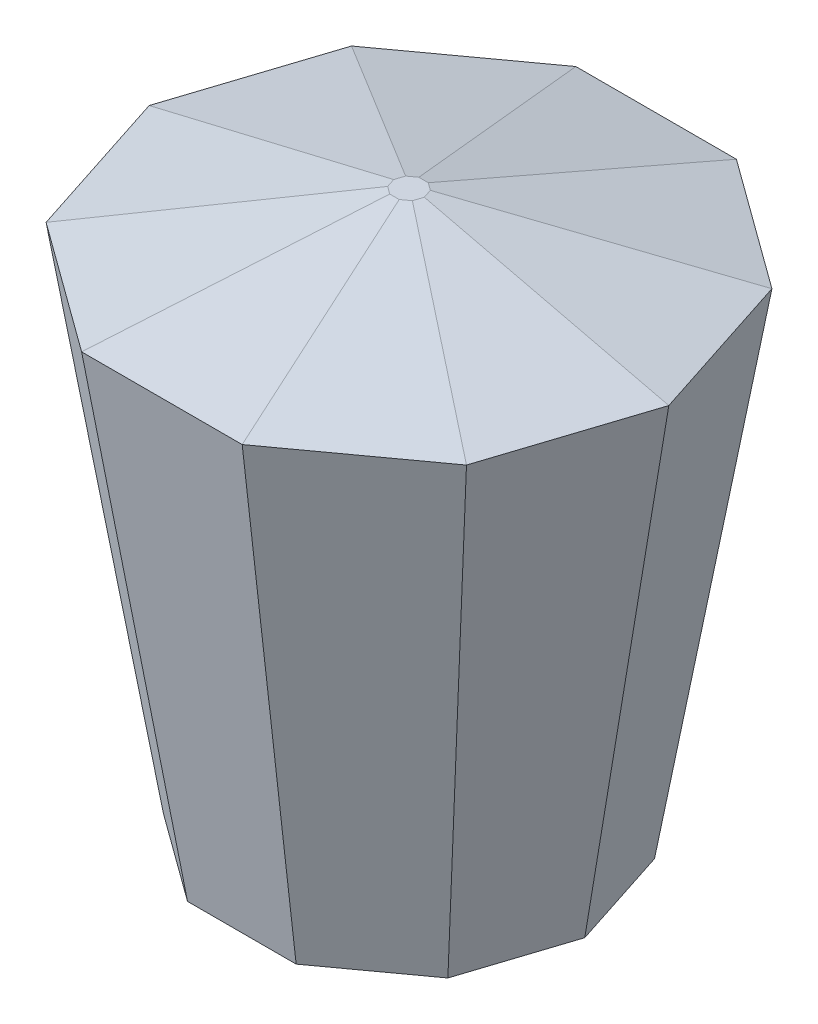
from build123d import *

# Parameters (mm, degrees)
CROQUIS5_R            = 1.5
CORTAR_EXTRUIR1_DEPTH = 18


with BuildPart() as part:
    # Croquis1 → Recubrir1 section 0
    with BuildSketch(Plane(origin=(0, 0, 0), x_dir=(1, 0, 0), z_dir=(0, 1, 0))):
        with BuildLine():
            Line((4.891242148, 3.553695435), (1.868288253, 5.75))
            Line((1.868288253, 5.75), (-1.868288253, 5.75))
            Line((-1.868288253, 5.75), (-4.891242148, 3.553695435))
            Line((-4.891242148, 3.553695435), (-6.045907789, 0))
            Line((-6.045907789, 0), (-4.891242148, -3.553695435))
            Line((-4.891242148, -3.553695435), (-1.868288253, -5.75))
            Line((-1.868288253, -5.75), (1.868288253, -5.75))
            Line((1.868288253, -5.75), (4.891242148, -3.553695435))
            Line((4.891242148, -3.553695435), (6.045907789, 0))
            Line((6.045907789, 0), (4.891242148, 3.553695435))
        make_face()
    # Croquis2 → Recubrir1 section 1
    with BuildSketch(Plane(origin=(0, 17.3, 0), x_dir=(1, 0, 0), z_dir=(0, 1, 0))):
        with BuildLine():
            Line((-8.937428906, 0), (-7.230531871, -5.253288904))
            Line((-7.230531871, -5.253288904), (-2.761817418, -8.5))
            Line((-2.761817418, -8.5), (2.761817418, -8.5))
            Line((2.761817418, -8.5), (7.230531871, -5.253288904))
            Line((7.230531871, -5.253288904), (8.937428906, 0))
            Line((8.937428906, 0), (7.230531871, 5.253288904))
            Line((7.230531871, 5.253288904), (2.761817418, 8.5))
            Line((2.761817418, 8.5), (-2.761817418, 8.5))
            Line((-2.761817418, 8.5), (-7.230531871, 5.253288904))
            Line((-7.230531871, 5.253288904), (-8.937428906, 0))
        make_face()
    loft()

    # Croquis4 → Recubrir2 section 0
    with BuildSketch(Plane(origin=(0, 19.3, 0), x_dir=(1, 0, 0), z_dir=(0, 1, 0))):
        with BuildLine():
            Line((-0.525731112, 0), (-0.425325404, -0.309016994))
            Line((-0.425325404, -0.309016994), (-0.162459848, -0.5))
            Line((-0.162459848, -0.5), (0.162459848, -0.5))
            Line((0.162459848, -0.5), (0.425325404, -0.309016994))
            Line((0.425325404, -0.309016994), (0.525731112, 0))
            Line((0.525731112, 0), (0.425325404, 0.309016994))
            Line((0.425325404, 0.309016994), (0.162459848, 0.5))
            Line((0.162459848, 0.5), (-0.162459848, 0.5))
            Line((-0.162459848, 0.5), (-0.425325404, 0.309016994))
            Line((-0.425325404, 0.309016994), (-0.525731112, 0))
        make_face()
    # Croquis2<3> → Recubrir2 section 1
    with BuildSketch(Plane(origin=(0, 17.3, 0), x_dir=(1, 0, 0), z_dir=(0, 1, 0))):
        with BuildLine():
            Line((-8.937428906, 0), (-7.230531871, -5.253288904))
            Line((-7.230531871, -5.253288904), (-2.761817418, -8.5))
            Line((-2.761817418, -8.5), (2.761817418, -8.5))
            Line((2.761817418, -8.5), (7.230531871, -5.253288904))
            Line((7.230531871, -5.253288904), (8.937428906, 0))
            Line((8.937428906, 0), (7.230531871, 5.253288904))
            Line((7.230531871, 5.253288904), (2.761817418, 8.5))
            Line((2.761817418, 8.5), (-2.761817418, 8.5))
            Line((-2.761817418, 8.5), (-7.230531871, 5.253288904))
            Line((-7.230531871, 5.253288904), (-8.937428906, 0))
        make_face()
    loft()

    # Croquis5 → Cortar-Extruir1 (cut)
    with BuildSketch(Plane.XZ):
        Circle(CROQUIS5_R)
    extrude(amount=-CORTAR_EXTRUIR1_DEPTH, mode=Mode.SUBTRACT)


solid = part.part
